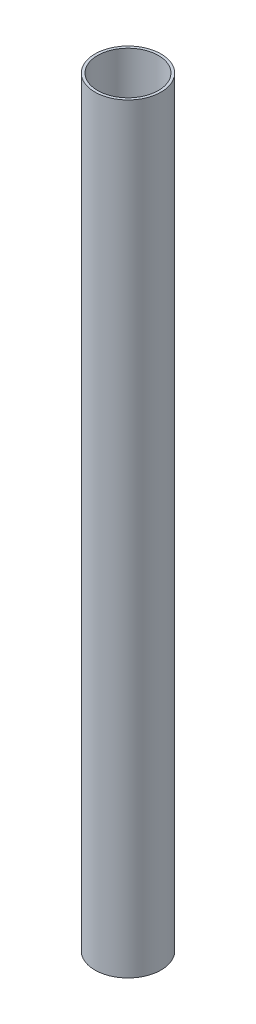
from build123d import *

# Parameters (mm, degrees)
SKETCH_1_R      = 12.5
SKETCH_1_R_2    = 11.5
EXTRUDE_1_DEPTH = 287.5


with BuildPart() as part:
    # 草图1 → 凸台-拉伸1 (new body)
    with BuildSketch(Plane(origin=(0, 0, 0), x_dir=(1, 0, 0), z_dir=(0, 1, 0))):
        with Locations(Location((0, 0, 0), (0, 0, 270))):
            Circle(SKETCH_1_R)
        with Locations(Location((0, 0, 0), (0, 0, 270))):
            Circle(SKETCH_1_R_2, mode=Mode.SUBTRACT)
    extrude(amount=EXTRUDE_1_DEPTH)


solid = part.part
